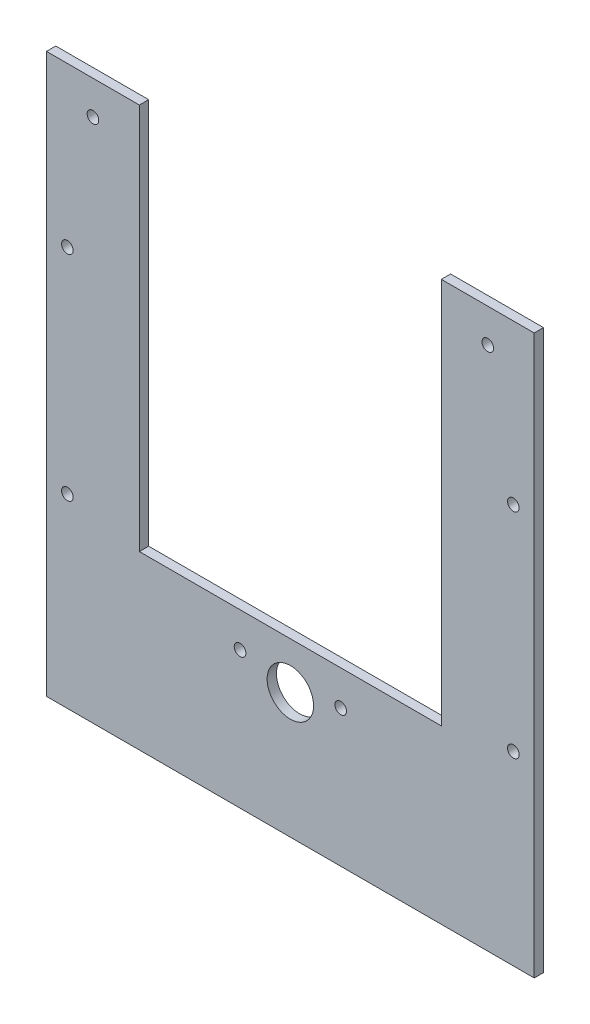
from build123d import *

# Parameters (mm, degrees)
CROQUIS1_R              = 2.5
CROQUIS1_R_2            = 10
SALIENTE_EXTRUIR1_DEPTH = 4


with BuildPart() as part:
    # Croquis1 → Saliente-Extruir1 (new body)
    with BuildSketch(Plane.XY):
        Polygon((-79.498385096, 944.128389678), (-79.498385096, 777.628389678), (50.501614904, 777.628389678), (50.501614904, 944.128389678), (90.501614904, 944.128389678), (90.501614904, 703.628389678), (-119.498385096, 703.628389678), (-119.498385096, 944.128389678), align=None)
        with Locations((70.501614904, 929.628389678)):
            Circle(CROQUIS1_R, mode=Mode.SUBTRACT)
        with Locations((81.501614904, 875.618389678)):
            Circle(CROQUIS1_R, mode=Mode.SUBTRACT)
        with Locations((81.501614904, 783.618389678)):
            Circle(CROQUIS1_R, mode=Mode.SUBTRACT)
        with Locations((-36.165051763, 762.628389678)):
            Circle(CROQUIS1_R, mode=Mode.SUBTRACT)
        with Locations((-110.498385096, 783.618389678)):
            Circle(CROQUIS1_R, mode=Mode.SUBTRACT)
        with Locations((-110.498385096, 875.618389678)):
            Circle(CROQUIS1_R, mode=Mode.SUBTRACT)
        with Locations((-99.498385096, 929.628389678)):
            Circle(CROQUIS1_R, mode=Mode.SUBTRACT)
        with Locations((7.168281571, 762.628389678)):
            Circle(CROQUIS1_R, mode=Mode.SUBTRACT)
        with Locations((-14.498385096, 757.628389678)):
            Circle(CROQUIS1_R_2, mode=Mode.SUBTRACT)
    extrude(amount=SALIENTE_EXTRUIR1_DEPTH)


solid = part.part
